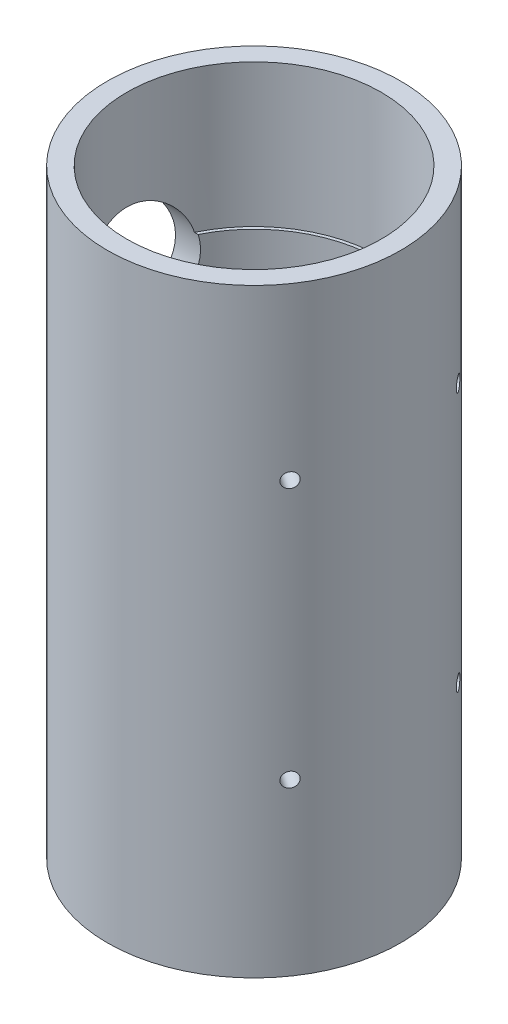
from build123d import *

# Parameters (mm, degrees)
SKETCH1_R           = 45.25
SKETCH1_R_2         = 38.25
BOSS_EXTRUDE1_DEPTH = 92.5
BOSS_EXTRUDE2_START = -6.35
SKETCH2_R           = 38.25
SKETCH2_R_2         = 36.25
BOSS_EXTRUDE2_DEPTH = 100
CUT_EXTRUDE3_START  = -44
SKETCH6_R           = 39.25
SKETCH6_R_2         = 38.25
CUT_EXTRUDE3_DEPTH  = 44
SKETCH7_R           = 17.5
CUT_EXTRUDE4_DEPTH  = 113.478331247
SKETCH10_R          = 2.25
CUT_EXTRUDE5_DEPTH  = 113.47833141


with BuildPart() as part:
    # Sketch1 → Boss-Extrude1 (new, symmetric)
    with BuildSketch(Plane(origin=(0, 0, 0), x_dir=(1, 0, 0), z_dir=(0, 1, 0))):
        with Locations(Location((0, 0, 0), (0, 0, 270))):
            Circle(SKETCH1_R)
        with Locations(Location((0, 0, 0), (0, 0, 270))):
            Circle(SKETCH1_R_2, mode=Mode.SUBTRACT)
    extrude(amount=BOSS_EXTRUDE1_DEPTH, both=True)

    # Sketch2 → Boss-Extrude2 (add)
    with BuildSketch(Plane.XZ.offset(92.5).offset(BOSS_EXTRUDE2_START)):
        with Locations(Location((0, 0, 0), (0, 0, 270))):
            Circle(SKETCH2_R)
        with Locations(Location((0, 0, 0), (0, 0, 270))):
            Circle(SKETCH2_R_2, mode=Mode.SUBTRACT)
    extrude(amount=-BOSS_EXTRUDE2_DEPTH)

    # Sketch6 → Cut-Extrude3 (cut)
    with BuildSketch(Plane(origin=(0, 92.5, 0), x_dir=(1, 0, 0), z_dir=(0, 1, 0)).offset(CUT_EXTRUDE3_START)):
        with Locations(Location((0, 0, 0), (0, 0, 270))):
            Circle(SKETCH6_R)
        with Locations(Location((0, 0, 0), (0, 0, 90))):
            Circle(SKETCH6_R_2, mode=Mode.SUBTRACT)
    extrude(amount=CUT_EXTRUDE3_DEPTH, mode=Mode.SUBTRACT)

    # Sketch7 → Cut-Extrude4 (cut, through all)
    with BuildSketch(Plane(origin=(0, 0, 0), x_dir=(0, 0, -1), z_dir=(1, 0, 0))):
        with Locations(Location((0, 44.35, 0), (0, 0, 13.717970606))):
            Circle(SKETCH7_R)
    extrude(amount=-CUT_EXTRUDE4_DEPTH, mode=Mode.SUBTRACT)

    # Sketch10 → Cut-Extrude5 (cut, through all)
    with BuildSketch(Plane(origin=(0, 0, 0), x_dir=(-0.5735764363510474, 0, -0.819152044288991), z_dir=(0.819152044288991, 0, -0.5735764363510474))):
        with Locations(Location((0, 40, 0), (0, 0, 180))):
            Circle(SKETCH10_R)
        with Locations(Location((0, -40, 0), (0, 0, 180))):
            Circle(SKETCH10_R)
    cut_extrude5 = extrude(amount=CUT_EXTRUDE5_DEPTH, mode=Mode.SUBTRACT)

    # Mirror1: Cut-Extrude5 across plane
    add(cut_extrude5.mirror(Plane.XY), mode=Mode.SUBTRACT)


solid = part.part
